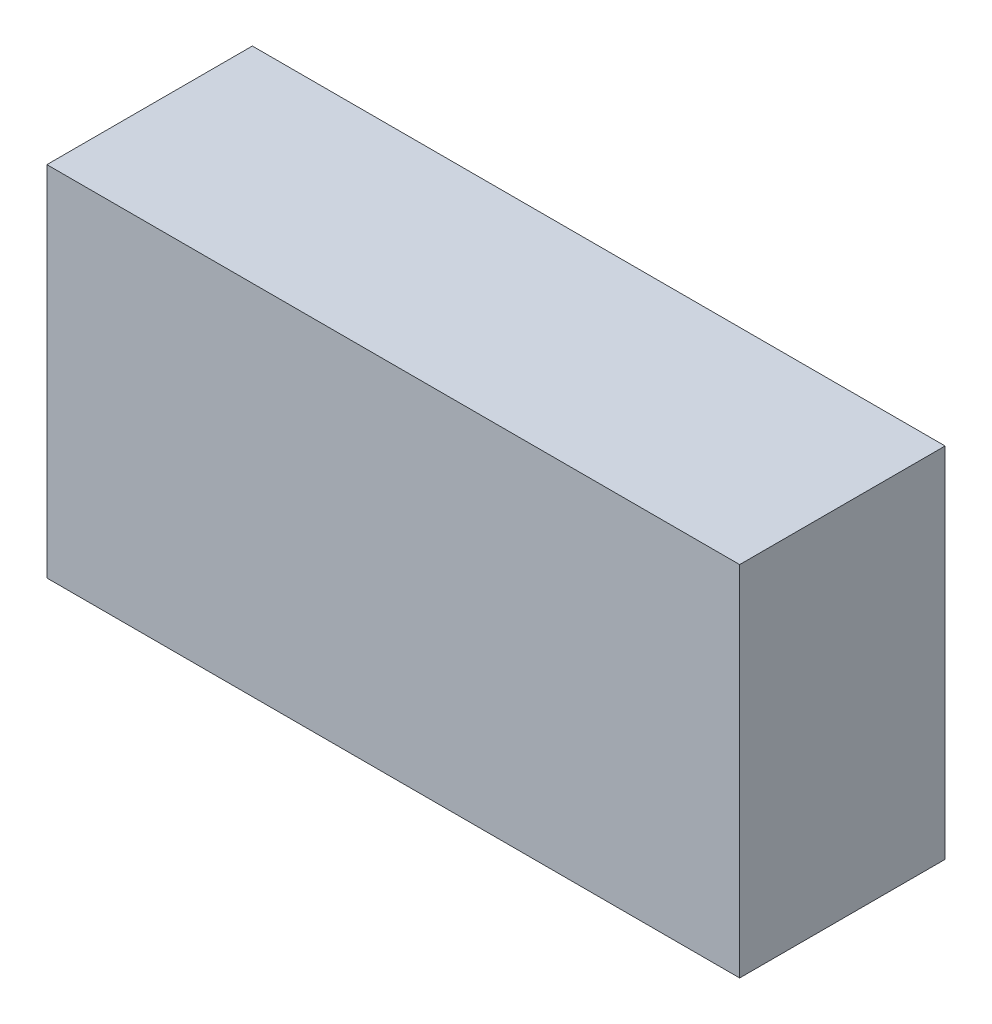
from build123d import *

# Parameters (mm, degrees)
SKETCH1_W      = 57.66
SKETCH1_H      = 29.8
ENVELOPE_DEPTH = 17.1


with BuildPart() as part:
    # Sketch1 → Envelope (new body)
    with BuildSketch(Plane.XY):
        Rectangle(SKETCH1_W, SKETCH1_H)
    extrude(amount=ENVELOPE_DEPTH)


solid = part.part
